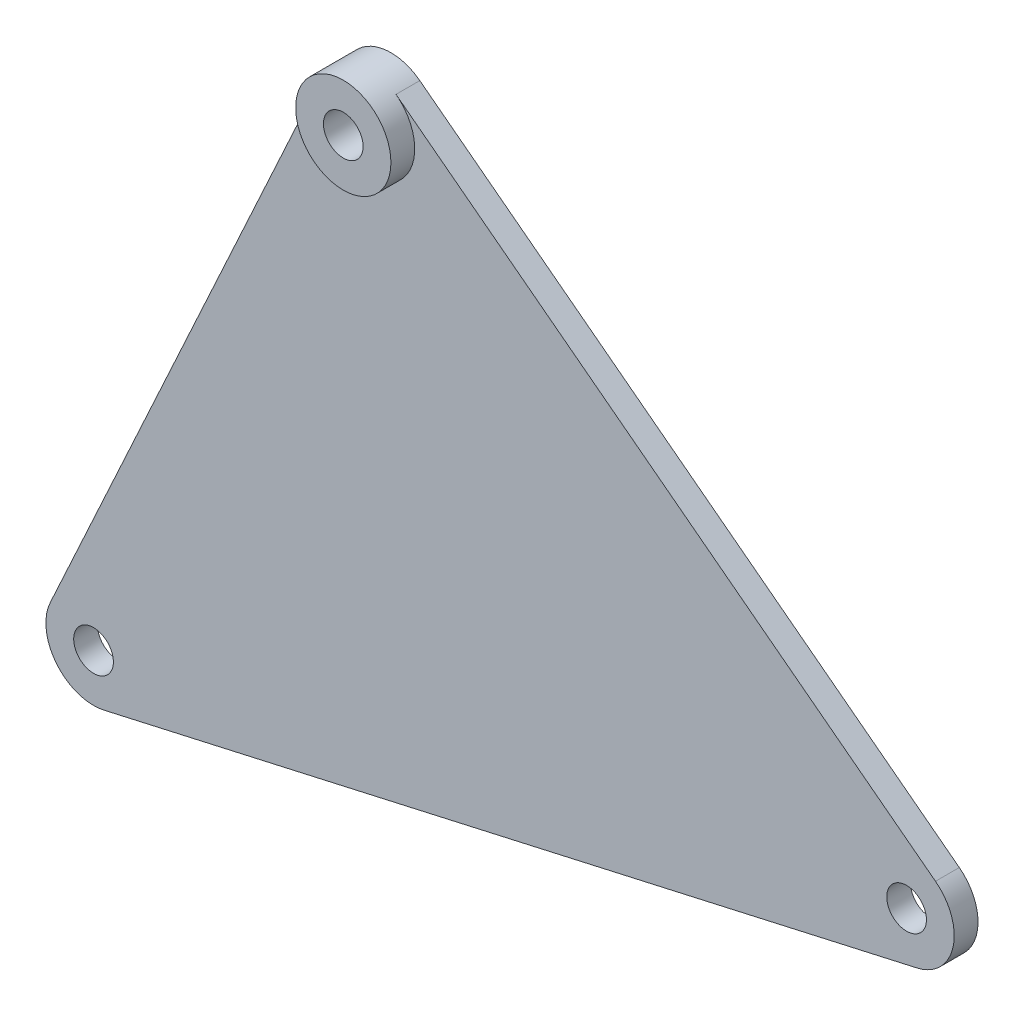
from build123d import *

# Parameters (mm, degrees)
SKETCH_1_R      = 6
SKETCH_1_R_2    = 2.5
EXTRUDE_1_DEPTH = 3
EXTRUDE_START   = 3
SKETCH_1_3_R    = 6
SKETCH_1_3_R_2  = 2.5
EXTRUDE_2_DEPTH = 3


with BuildPart() as part:
    # 草图1 → 凸台-拉伸1 (new body)
    # profile 1 of 4: a face of its own
    with BuildSketch(Plane.XY):
        with BuildLine():
            ThreePointArc((40.464305263, 74.956398411), (33.181387998, 69.095159353), (29.012930833, 77.462893339))
            Line((29.012930833, 77.462893339), (-5.45137443, 2.506494928))
            ThreePointArc((-5.45137443, 2.506494928), (1.282917266, 5.861239058), (6, 0))
            ThreePointArc((6, 0), (4.685854424, -3.747368186), (1.319077226, -5.853207264))
            Line((1.319077226, -5.853207264), (103.75020434, 17.230644193))
            ThreePointArc((103.75020434, 17.230644193), (96.5694233, 24.364643554), (106.071305848, 27.85345299))
            Line((106.071305848, 27.85345299), (38.104483997, 79.725999944))
            ThreePointArc((38.104483997, 79.725999944), (39.842086981, 77.61712459), (40.464305263, 74.956398411))
        make_face()
    # profile 2 of 4: a face of its own
    with BuildSketch(Plane.XY):
        with Locations((34.464305263, 74.956398411)):
            Circle(SKETCH_1_R)
        with Locations((34.464305263, 74.956398411)):
            Circle(SKETCH_1_R_2, mode=Mode.SUBTRACT)
    # profile 3 of 4: a face of its own
    with BuildSketch(Plane.XY):
        Circle(SKETCH_1_R)
        Circle(SKETCH_1_R_2, mode=Mode.SUBTRACT)
    # profile 4 of 4: a face of its own
    with BuildSketch(Plane.XY):
        with Locations((102.431127114, 23.083851457)):
            Circle(SKETCH_1_R)
        with Locations((102.431127114, 23.083851457)):
            Circle(SKETCH_1_R_2, mode=Mode.SUBTRACT)
    extrude(amount=EXTRUDE_1_DEPTH)

    # 草图1<3> → 凸台-拉伸2 (add)
    with BuildSketch(Plane.XY.offset(EXTRUDE_START)):
        with Locations(Location((34.464305263, 74.956398411, 0), (0, 0, 155.307436438))):
            Circle(SKETCH_1_3_R)
        with Locations((34.464305263, 74.956398411)):
            Circle(SKETCH_1_3_R_2, mode=Mode.SUBTRACT)
    extrude(amount=EXTRUDE_2_DEPTH)


solid = part.part
